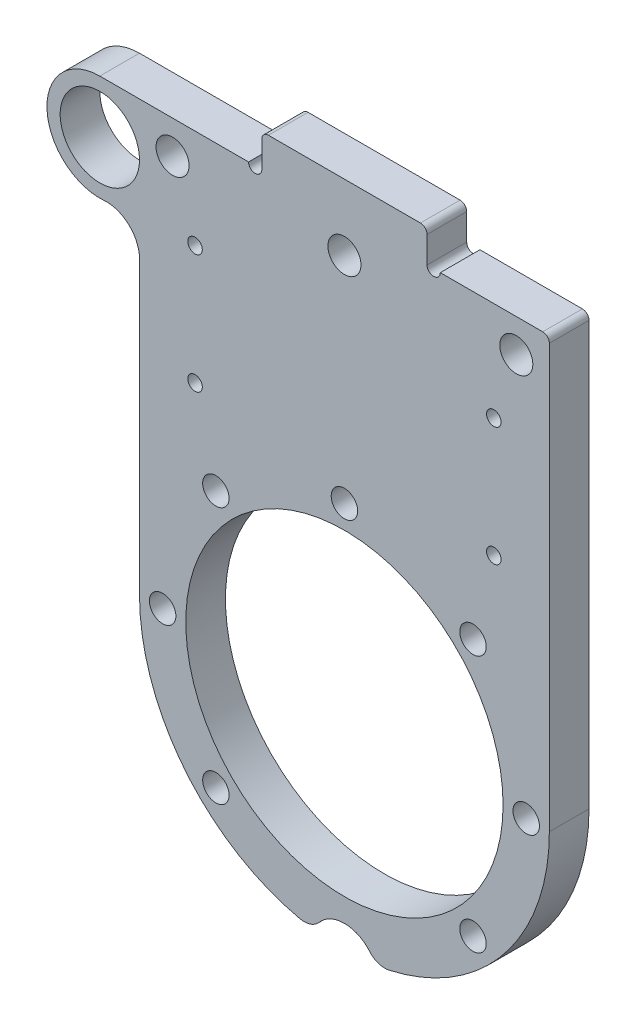
from build123d import *

# Parameters (mm, degrees)
SKETCH_1_R          = 24
SKETCH_1_R_2        = 2
SKETCH_1_R_3        = 2.5
SKETCH_1_R_4        = 1.1
SKETCH_1_R_5        = 6
EXTRUDE_1_DEPTH     = 6
SKETCH_2_R          = 1
CUT_EXTRUDE_1_DEPTH = 84.432607534
FILLET_1_R          = 1


with BuildPart() as part:
    # 草图1 → 凸台-拉伸1 (new body)
    with BuildSketch(Plane.XY):
        with BuildLine():
            Line((-31, 0), (-31, 44.038518603))
            ThreePointArc((-31, 44.038518603), (-32.603168898, 47.707515532), (-36.384615385, 49.023703756))
            ThreePointArc((-36.384615385, 49.023703756), (-44.994071865, 56.692079518), (-37, 65))
            Line((-37, 65), (-12.5, 65))
            Line((-12.5, 65), (-12.5, 70))
            Line((-12.5, 70), (12.5, 70))
            Line((12.5, 70), (12.5, 65))
            Line((12.5, 65), (31, 65))
            Line((31, 65), (31, 0))
            ThreePointArc((31, 0), (24.191352338, -19.385006373), (6.756227609, -30.254807692))
            ThreePointArc((6.756227609, -30.254807692), (5.147421514, -30.170867126), (3.813999457, -29.266826923))
            ThreePointArc((3.813999457, -29.266826923), (0, -27.5), (-3.813999457, -29.266826923))
            ThreePointArc((-3.813999457, -29.266826923), (-5.147421514, -30.170867126), (-6.756227609, -30.254807692))
            ThreePointArc((-6.756227609, -30.254807692), (-24.191352338, -19.385006373), (-31, 0))
        make_face()
        Circle(SKETCH_1_R, mode=Mode.SUBTRACT)
        with Locations((-19.445436483, 19.445436483)):
            Circle(SKETCH_1_R_2, mode=Mode.SUBTRACT)
        with Locations((0, 27.5)):
            Circle(SKETCH_1_R_2, mode=Mode.SUBTRACT)
        with Locations((19.445436483, 19.445436483)):
            Circle(SKETCH_1_R_2, mode=Mode.SUBTRACT)
        with Locations((27.5, 0)):
            Circle(SKETCH_1_R_2, mode=Mode.SUBTRACT)
        with Locations((19.445436483, -19.445436483)):
            Circle(SKETCH_1_R_2, mode=Mode.SUBTRACT)
        with Locations((-19.445436483, -19.445436483)):
            Circle(SKETCH_1_R_2, mode=Mode.SUBTRACT)
        with Locations((-27.5, 0)):
            Circle(SKETCH_1_R_2, mode=Mode.SUBTRACT)
        with Locations((-26, 60)):
            Circle(SKETCH_1_R_3, mode=Mode.SUBTRACT)
        with Locations((0, 60)):
            Circle(SKETCH_1_R_3, mode=Mode.SUBTRACT)
        with Locations((26, 60)):
            Circle(SKETCH_1_R_3, mode=Mode.SUBTRACT)
        with Locations((-22.6, 50)):
            Circle(SKETCH_1_R_4, mode=Mode.SUBTRACT)
        with Locations((-22.6, 32)):
            Circle(SKETCH_1_R_4, mode=Mode.SUBTRACT)
        with Locations((22.6, 32)):
            Circle(SKETCH_1_R_4, mode=Mode.SUBTRACT)
        with Locations((22.6, 50)):
            Circle(SKETCH_1_R_4, mode=Mode.SUBTRACT)
        with Locations((-37, 57)):
            Circle(SKETCH_1_R_5, mode=Mode.SUBTRACT)
    extrude(amount=EXTRUDE_1_DEPTH)

    # 草图2 → 切除-拉伸1 (cut, through all)
    with BuildSketch(Plane.XY.offset(6)):
        with Locations((-13.5, 65)):
            Circle(SKETCH_2_R)
        with Locations((13.5, 65)):
            Circle(SKETCH_2_R)
    extrude(amount=-CUT_EXTRUDE_1_DEPTH, mode=Mode.SUBTRACT)

    # 圆角1
    fillet_1_edges = [part.edges().sort_by_distance(p)[0] for p in [
        (-12.5, 70, 3),
        (12.5, 70, 3),
        (31, 65, 3),
    ]]
    fillet(fillet_1_edges, radius=FILLET_1_R)


solid = part.part
